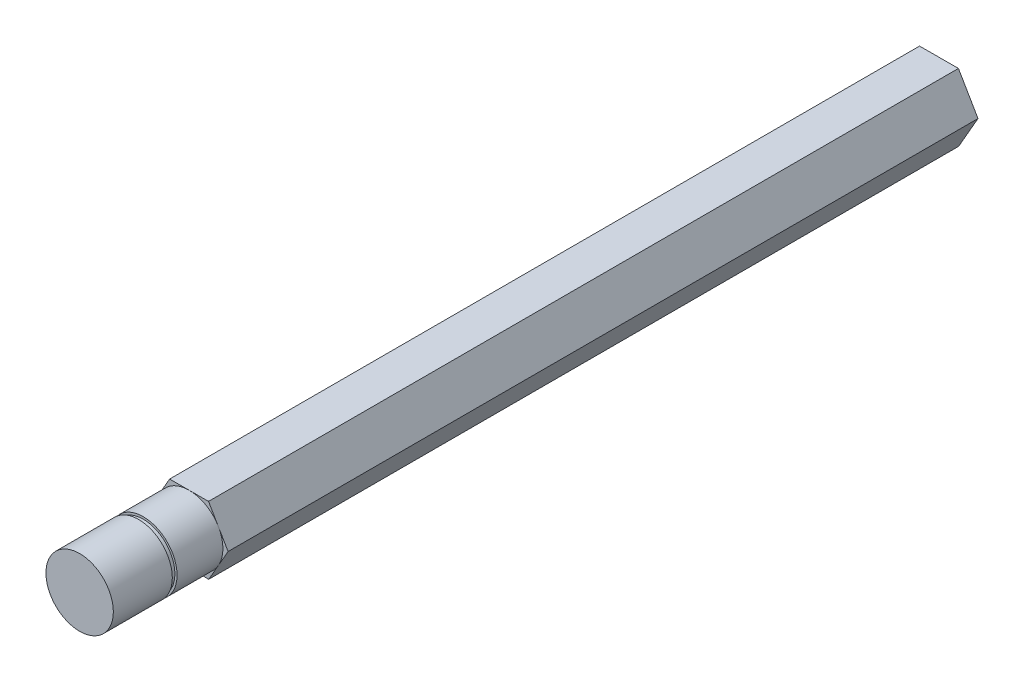
from build123d import *

# Parameters (mm, degrees)
BOSS_EXTRUDE1_DEPTH = 76.2
SKETCH2_R           = 7.332348419
SKETCH2_R_2         = 6.35
CUT_EXTRUDE1_DEPTH  = 11.1125
BOSS_EXTRUDE2_START = 9.525
SKETCH3_R           = 6.35
BOSS_EXTRUDE2_DEPTH = 9.525
SKETCH4_R           = 7.332348419
SKETCH4_R_2         = 5.9436
CUT_EXTRUDE2_DEPTH  = 0.889


with BuildPart() as part:
    # Sketch1 → Boss-Extrude1 (new, symmetric)
    with BuildSketch(Plane.XY):
        Polygon((3.684589596, -6.339332208), (7.332317533, 0.021282089), (3.647727937, 6.360614297), (-3.684589596, 6.339332208), (-7.332317533, -0.021282089), (-3.647727937, -6.360614297), align=None)
    extrude(amount=BOSS_EXTRUDE1_DEPTH, both=True)

    # Sketch2 → Cut-Extrude1 (cut)
    with BuildSketch(Plane.XY.offset(76.2)):
        Circle(SKETCH2_R)
        Circle(SKETCH2_R_2, mode=Mode.SUBTRACT)
    extrude(amount=-CUT_EXTRUDE1_DEPTH, mode=Mode.SUBTRACT)

    # Sketch3 → Boss-Extrude2 (add)
    with BuildSketch(Plane.XY.offset(76.2).offset(BOSS_EXTRUDE2_START)):
        Circle(SKETCH3_R)
    extrude(amount=-BOSS_EXTRUDE2_DEPTH)

    # Sketch4 → Cut-Extrude2 (cut)
    with BuildSketch(Plane.XY.offset(74.6125)):
        Circle(SKETCH4_R)
        Circle(SKETCH4_R_2, mode=Mode.SUBTRACT)
    extrude(amount=-CUT_EXTRUDE2_DEPTH, mode=Mode.SUBTRACT)


solid = part.part
